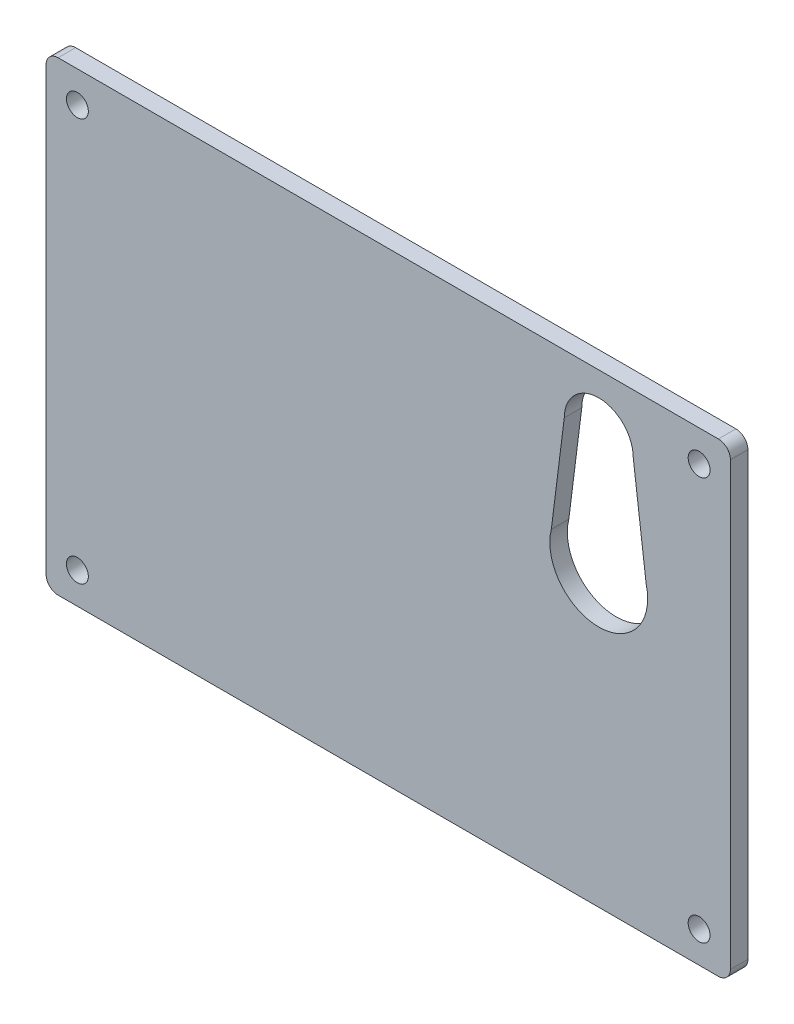
from build123d import *

# Parameters (mm, degrees)
SKETCH1_R           = 1.25
BOSS_EXTRUDE1_DEPTH = 2


with BuildPart() as part:
    # Sketch1 → Boss-Extrude1 (new body)
    with BuildSketch(Plane.XY):
        with BuildLine():
            ThreePointArc((48.610141298, 25.924362859), (48.207413123, 26.896634683), (47.235141298, 27.299362859))
            Line((47.235141298, 27.299362859), (-28.164858702, 27.299362859))
            ThreePointArc((-28.164858702, 27.299362859), (-29.137130526, 26.896634683), (-29.539858702, 25.924362859))
            Line((-29.539858702, 25.924362859), (-29.539858702, -24.475637141))
            ThreePointArc((-29.539858702, -24.475637141), (-29.137130526, -25.447908965), (-28.164858702, -25.850637141))
            Line((-28.164858702, -25.850637141), (47.235141298, -25.850637141))
            ThreePointArc((47.235141298, -25.850637141), (48.207413123, -25.447908965), (48.610141298, -24.475637141))
            Line((48.610141298, -24.475637141), (48.610141298, 25.924362859))
        make_face()
        with Locations((-25.964858702, -22.275637141)):
            Circle(SKETCH1_R, mode=Mode.SUBTRACT)
        with Locations((45.035141298, -22.275637141)):
            Circle(SKETCH1_R, mode=Mode.SUBTRACT)
        with Locations((-25.964858702, 23.724362859)):
            Circle(SKETCH1_R, mode=Mode.SUBTRACT)
        with BuildLine():
            ThreePointArc((29.638141298, 20.602682845), (33.575141298, 24.539682845), (37.512141298, 20.602682845))
            Line((37.512141298, 20.602682845), (38.989636745, 8.837022391))
            ThreePointArc((38.989636745, 8.837022391), (33.575141298, 1.867362859), (28.160645852, 8.837022391))
            Line((28.160645852, 8.837022391), (29.638141298, 20.602682845))
        make_face(mode=Mode.SUBTRACT)
        with Locations((45.035141298, 23.724362859)):
            Circle(SKETCH1_R, mode=Mode.SUBTRACT)
    extrude(amount=BOSS_EXTRUDE1_DEPTH)


solid = part.part
